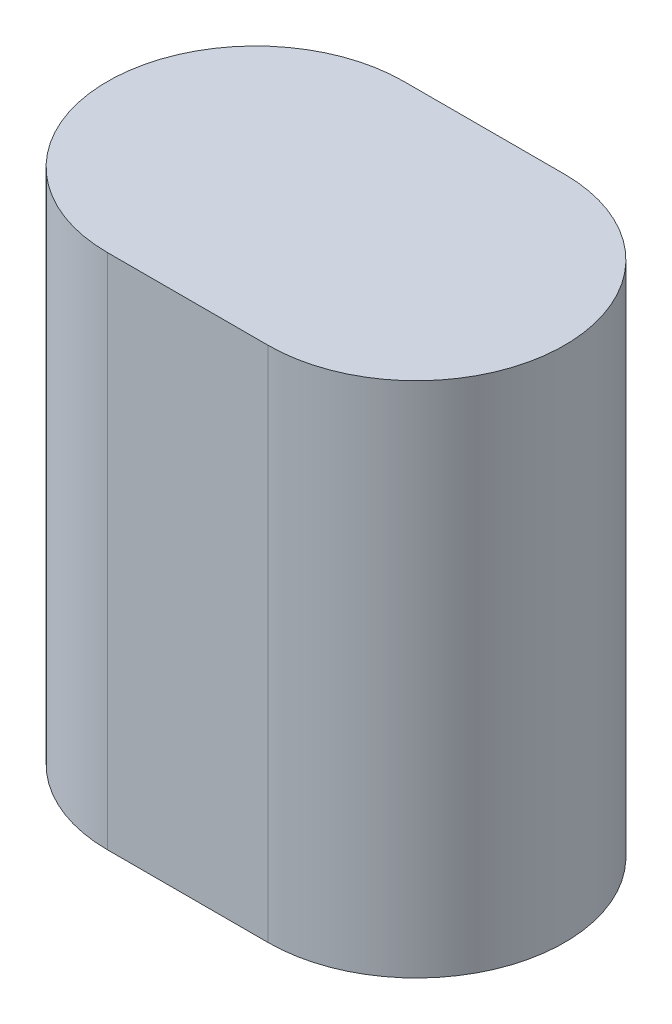
from build123d import *

# Parameters (mm, degrees)
BOSS_EXTRUDE1_DEPTH = 51.5


with BuildPart() as part:
    # Sketch3 → Boss-Extrude1 (new body)
    with BuildSketch(Plane(origin=(0, 0, 0), x_dir=(1, 0, 0), z_dir=(0, 1, 0))):
        with BuildLine():
            Line((-8, 14.75565), (8, 14.75565))
            ThreePointArc((8, 14.75565), (22.75565, 0), (8, -14.75565))
            Line((8, -14.75565), (-8, -14.75565))
            ThreePointArc((-8, -14.75565), (-22.75565, 0), (-8, 14.75565))
        make_face()
    extrude(amount=BOSS_EXTRUDE1_DEPTH)


solid = part.part
